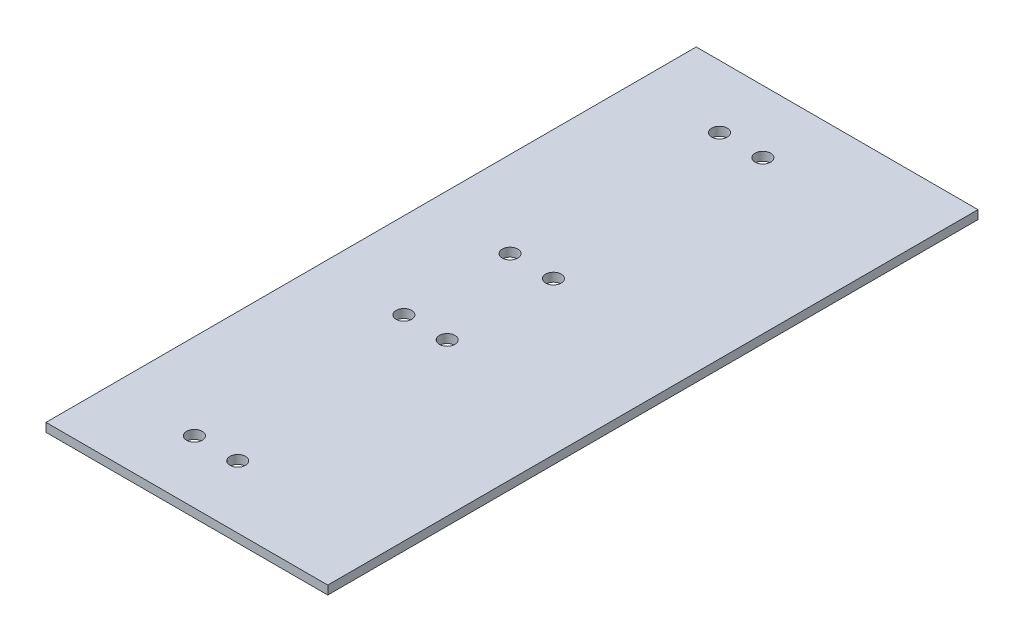
from build123d import *

# Parameters (mm, degrees)
CROQUIS1_W              = 65
CROQUIS1_H              = 150
CROQUIS1_R              = 1.8
SALIENTE_EXTRUIR1_DEPTH = 2


with BuildPart() as part:
    # Croquis1 → Saliente-Extruir1 (new body)
    with BuildSketch(Plane(origin=(0, 0, 0), x_dir=(1, 0, 0), z_dir=(0, 1, 0))):
        Rectangle(CROQUIS1_W, CROQUIS1_H)
        with Locations(Location((-2.7, 12.25, 0), (0, 0, 270))):
            Circle(CROQUIS1_R, mode=Mode.SUBTRACT)
        with Locations(Location((-2.7, 60.57, 0), (0, 0, 270))):
            Circle(CROQUIS1_R, mode=Mode.SUBTRACT)
        with Locations(Location((-12.7, -60.57, 0), (0, 0, 90))):
            Circle(CROQUIS1_R, mode=Mode.SUBTRACT)
        with Locations(Location((-2.7, -60.57, 0), (0, 0, 90))):
            Circle(CROQUIS1_R, mode=Mode.SUBTRACT)
        with Locations(Location((-12.7, 12.25, 0), (0, 0, 270))):
            Circle(CROQUIS1_R, mode=Mode.SUBTRACT)
        with Locations(Location((-12.7, 60.57, 0), (0, 0, 270))):
            Circle(CROQUIS1_R, mode=Mode.SUBTRACT)
        with Locations(Location((-12.7, -12.25, 0), (0, 0, 90))):
            Circle(CROQUIS1_R, mode=Mode.SUBTRACT)
        with Locations(Location((-2.7, -12.25, 0), (0, 0, 90))):
            Circle(CROQUIS1_R, mode=Mode.SUBTRACT)
    extrude(amount=SALIENTE_EXTRUIR1_DEPTH)


solid = part.part
